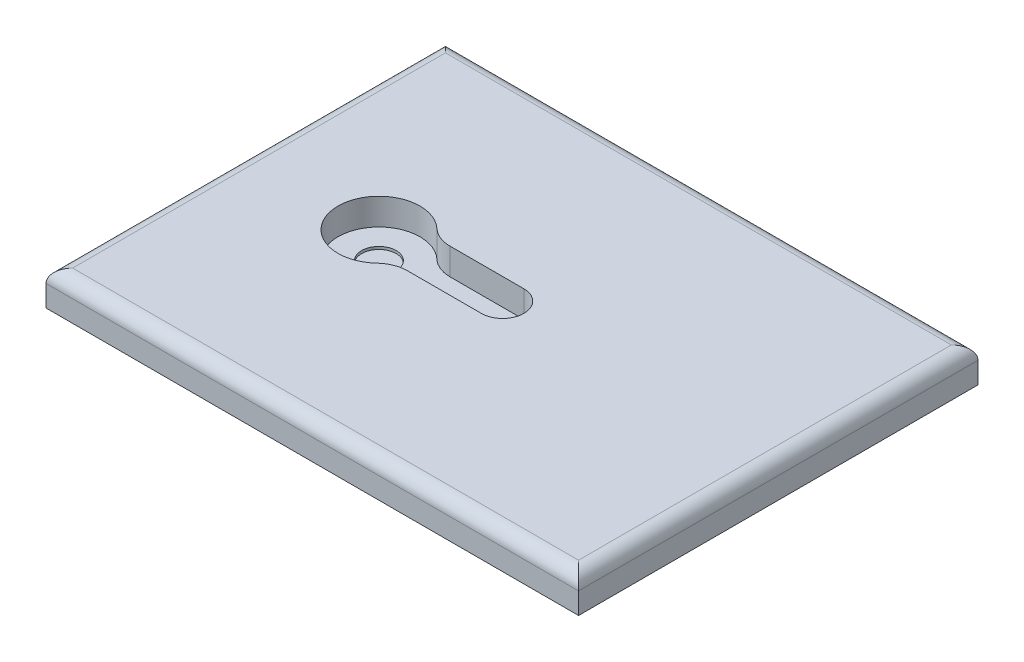
from build123d import *

# Parameters (mm, degrees)
SKETCH2_W           = 100
SKETCH2_H           = 75
BOSS_EXTRUDE1_DEPTH = 6.5
FILLET1_R           = 2.5
CUT_EXTRUDE1_DEPTH  = 5
FILLET3_R           = 6
SKETCH4_R           = 3.25
CUT_EXTRUDE2_DEPTH  = 0.5


with BuildPart() as part:
    # Sketch2 → Boss-Extrude1 (new body)
    with BuildSketch(Plane(origin=(0, 0, 0), x_dir=(1, 0, 0), z_dir=(0, 1, 0))):
        with Locations((14.972577697, -13.514625229)):
            Rectangle(SKETCH2_W, SKETCH2_H)
    extrude(amount=BOSS_EXTRUDE1_DEPTH)

    # Fillet1
    fillet1_edges = [part.edges().sort_by_distance(p)[0] for p in [
        (64.972577697, 6.5, 13.514625229),
        (14.972577697, 6.5, -23.985374771),
        (-35.027422303, 6.5, 13.514625229),
        (14.972577697, 6.5, 51.014625229),
    ]]
    fillet(fillet1_edges, radius=FILLET1_R)

    # Sketch3 → Cut-Extrude1 (cut)
    with BuildSketch(Plane(origin=(0, 6.5, 0), x_dir=(1, 0, 0), z_dir=(0, 1, 0))):
        with BuildLine():
            Line((-3.42616702, -9.514625229), (13.213071542, -9.514625229))
            ThreePointArc((13.213071542, -9.514625229), (17.213071542, -13.514625229), (13.213071542, -17.514625229))
            Line((13.213071542, -17.514625229), (-3.42616702, -17.514625229))
            ThreePointArc((-3.42616702, -17.514625229), (-17.70568068, -13.514625229), (-3.42616702, -9.514625229))
        make_face()
    extrude(amount=-CUT_EXTRUDE1_DEPTH, mode=Mode.SUBTRACT)

    # Fillet3
    fillet3_edges = [part.edges().sort_by_distance(p)[0] for p in [
        (-3.42616702, 4, 17.514625229),
        (-3.42616702, 4, 9.514625229),
    ]]
    fillet(fillet3_edges, radius=FILLET3_R)

    # Sketch4 → Cut-Extrude2 (cut)
    with BuildSketch(Plane(origin=(0, 1.5, 0), x_dir=(1, 0, 0), z_dir=(0, 1, 0))):
        with Locations(Location((-9.992086902, -13.532706959, 0), (0, 0, 270))):
            Circle(SKETCH4_R)
    extrude(amount=-CUT_EXTRUDE2_DEPTH, mode=Mode.SUBTRACT)


solid = part.part
